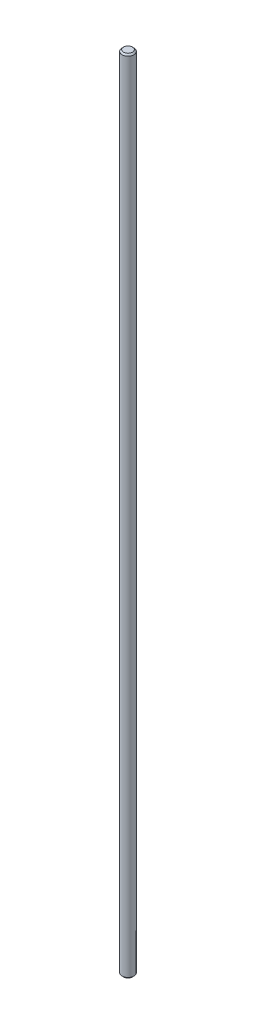
from build123d import *

# Parameters (mm, degrees)
SKETCH_1_R      = 2
EXTRUDE_1_DEPTH = 135
CHAMFER_1_SIZE  = 0.5


with BuildPart() as part:
    # 草图1 → 凸台-拉伸1 (new, symmetric)
    with BuildSketch(Plane(origin=(0, 0, 0), x_dir=(1, 0, 0), z_dir=(0, 1, 0))):
        with Locations(Location((0, 0, 0), (0, 0, 270))):
            Circle(SKETCH_1_R)
    extrude(amount=EXTRUDE_1_DEPTH, both=True)

    # 倒角1
    chamfer_1_edges = [part.edges().sort_by_distance(p)[0] for p in [
        (0, -135, -2),
        (0, 135, -2),
    ]]
    chamfer(chamfer_1_edges, length=CHAMFER_1_SIZE)


solid = part.part
